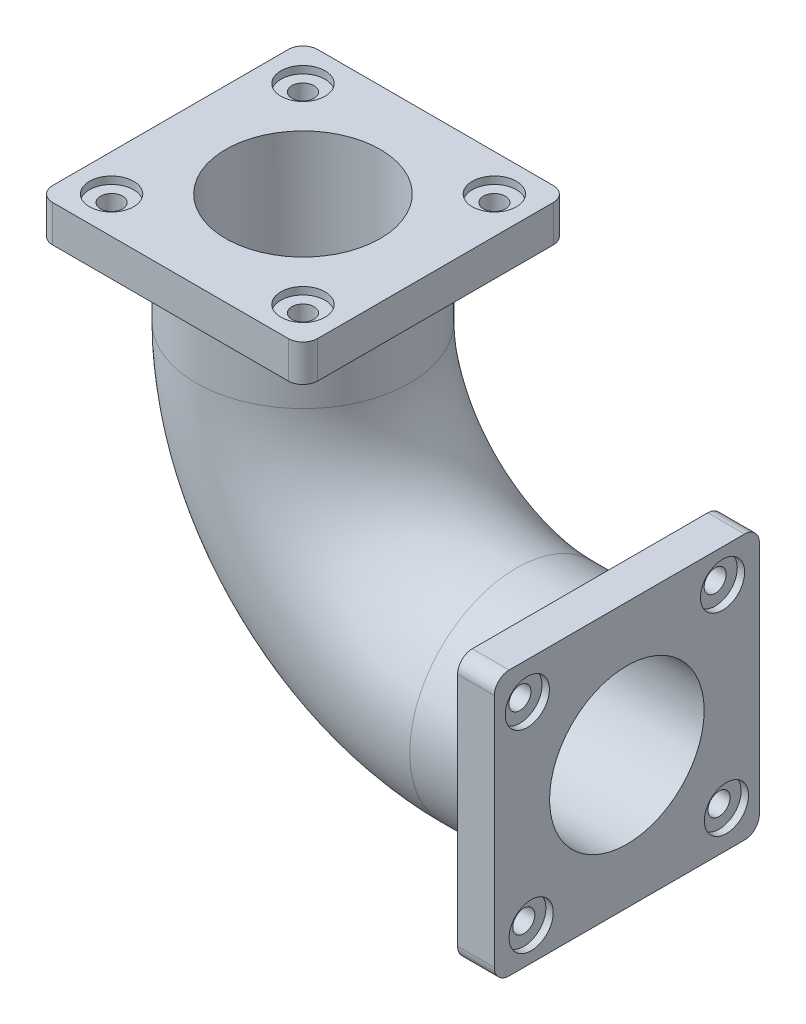
from build123d import *

# Parameters (mm, degrees)
SKETCH2_R           = 145
SKETCH2_R_2         = 105
BOSS_EXTRUDE1_START = -50
SKETCH3_W           = 360
SKETCH3_H           = 360
SKETCH3_R           = 145
BOSS_EXTRUDE1_DEPTH = 50
FILLET1_R           = 20
SKETCH4_W           = 360
SKETCH4_H           = 360
SKETCH4_R           = 145
BOSS_EXTRUDE2_DEPTH = 50
FILLET2_R           = 20
SKETCH6_R           = 30
CUT_EXTRUDE1_DEPTH  = 10
CUT_EXTRUDE2_REACH  = 775.369
SKETCH8_R           = 15
CIRPATTERN1_COUNT   = 4
SKETCH10_R          = 30
CUT_EXTRUDE3_DEPTH  = 10
CUT_EXTRUDE4_REACH  = 890.2
SKETCH11_R          = 15
CIRPATTERN3_COUNT   = 4


with BuildPart() as part:
    # Sweep-Thin1: sweep along a path in Sketch1
    with BuildLine(Plane.XY) as sweep_thin1_path:
        Line((0, 0), (-150, 0))
        ThreePointArc((-150, 0), (-355.060966544, 84.939033456), (-440, 290))
        Line((-440, 290), (-440, 440))
    # Sketch2 → Sweep-Thin1 (sweep)
    with BuildSketch(Plane(origin=(0, 0, 0), x_dir=(0, 0, -1), z_dir=(1, 0, 0))):
        Circle(SKETCH2_R)
        Circle(SKETCH2_R_2, mode=Mode.SUBTRACT)
    sweep(path=sweep_thin1_path.line)

    # Sketch3 → Boss-Extrude1 (add)
    with BuildSketch(Plane(origin=(0, 0, 0), x_dir=(0, 0, -1), z_dir=(1, 0, 0)).offset(BOSS_EXTRUDE1_START)):
        Rectangle(SKETCH3_W, SKETCH3_H)
        with Locations(Location((0, 0, 0), (0, 0, 270))):
            Circle(SKETCH3_R, mode=Mode.SUBTRACT)
    extrude(amount=BOSS_EXTRUDE1_DEPTH)

    # Fillet1
    fillet1_edges = [part.edges().sort_by_distance(p)[0] for p in [
        (-25, -180, 180),
        (-25, 180, 180),
        (-25, 180, -180),
        (-25, -180, -180),
    ]]
    fillet(fillet1_edges, radius=FILLET1_R)

    # Sketch4 → Boss-Extrude2 (add)
    with BuildSketch(Plane(origin=(0, 440, 0), x_dir=(1, 0, 0), z_dir=(0, 1, 0))):
        with Locations((-440, 0)):
            Rectangle(SKETCH4_W, SKETCH4_H)
        with Locations(Location((-440, 0, 0), (0, 0, 180))):
            Circle(SKETCH4_R, mode=Mode.SUBTRACT)
    extrude(amount=-BOSS_EXTRUDE2_DEPTH)

    # Fillet2
    fillet2_edges = [part.edges().sort_by_distance(p)[0] for p in [
        (-620, 415, 180),
        (-620, 415, -180),
        (-260, 415, -180),
        (-260, 415, 180),
    ]]
    fillet(fillet2_edges, radius=FILLET2_R)

    # Sketch6 → Cut-Extrude1 (cut)
    with BuildSketch(Plane(origin=(0, 0, 0), x_dir=(0, 0, -1), z_dir=(1, 0, 0))):
        with Locations((-135.239614092, 130)):
            Circle(SKETCH6_R)
    cut_extrude1 = extrude(amount=-CUT_EXTRUDE1_DEPTH, mode=Mode.SUBTRACT)

    # Sketch8 → Cut-Extrude2 (cut, up to next)
    with BuildSketch(Plane(origin=(-10, 0, 0), x_dir=(0, 0, -1), z_dir=(1, 0, 0)), mode=Mode.PRIVATE) as cut_extrude2_sk1:
        with Locations((-135.239614092, 130)):
            Circle(SKETCH8_R)
    cut_extrude2_tool1 = extrude(cut_extrude2_sk1.sketch, amount=-CUT_EXTRUDE2_REACH, mode=Mode.PRIVATE) & part.part
    cut_extrude2 = cut_extrude2_tool1.solids().sort_by_distance((-10, 130, 135.239614))[0]
    add(cut_extrude2, mode=Mode.SUBTRACT)

    # CirPattern1: Cut-Extrude1, Cut-Extrude2 ×4 about axis
    cirpattern1_axis = Axis((0, 0, 0), (1, 0, 0))
    add([cut_extrude1.rotate(cirpattern1_axis, i * 360 / CIRPATTERN1_COUNT) for i in range(1, CIRPATTERN1_COUNT)], mode=Mode.SUBTRACT)
    add([cut_extrude2.rotate(cirpattern1_axis, i * 360 / CIRPATTERN1_COUNT) for i in range(1, CIRPATTERN1_COUNT)], mode=Mode.SUBTRACT)

    # Sketch10 → Cut-Extrude3 (cut)
    with BuildSketch(Plane(origin=(0, 440, 0), x_dir=(1, 0, 0), z_dir=(0, 1, 0))):
        with Locations(Location((-570, 130, 0), (0, 0, 180))):
            Circle(SKETCH10_R)
    cut_extrude3 = extrude(amount=-CUT_EXTRUDE3_DEPTH, mode=Mode.SUBTRACT)

    # Sketch11 → Cut-Extrude4 (cut, up to next)
    with BuildSketch(Plane(origin=(0, 430, 0), x_dir=(1, 0, 0), z_dir=(0, 1, 0)), mode=Mode.PRIVATE) as cut_extrude4_sk1:
        with Locations(Location((-570, 130, 0), (0, 0, 180))):
            Circle(SKETCH11_R)
    cut_extrude4_tool1 = extrude(cut_extrude4_sk1.sketch, amount=-CUT_EXTRUDE4_REACH, mode=Mode.PRIVATE) & part.part
    cut_extrude4 = cut_extrude4_tool1.solids().sort_by_distance((-570, 430, -130))[0]
    add(cut_extrude4, mode=Mode.SUBTRACT)

    # CirPattern3: Cut-Extrude3, Cut-Extrude4 ×4 about axis
    cirpattern3_axis = Axis((-440, 0, 0), (0, 1, 0))
    add([cut_extrude3.rotate(cirpattern3_axis, i * 360 / CIRPATTERN3_COUNT) for i in range(1, CIRPATTERN3_COUNT)], mode=Mode.SUBTRACT)
    add([cut_extrude4.rotate(cirpattern3_axis, i * 360 / CIRPATTERN3_COUNT) for i in range(1, CIRPATTERN3_COUNT)], mode=Mode.SUBTRACT)


solid = part.part
